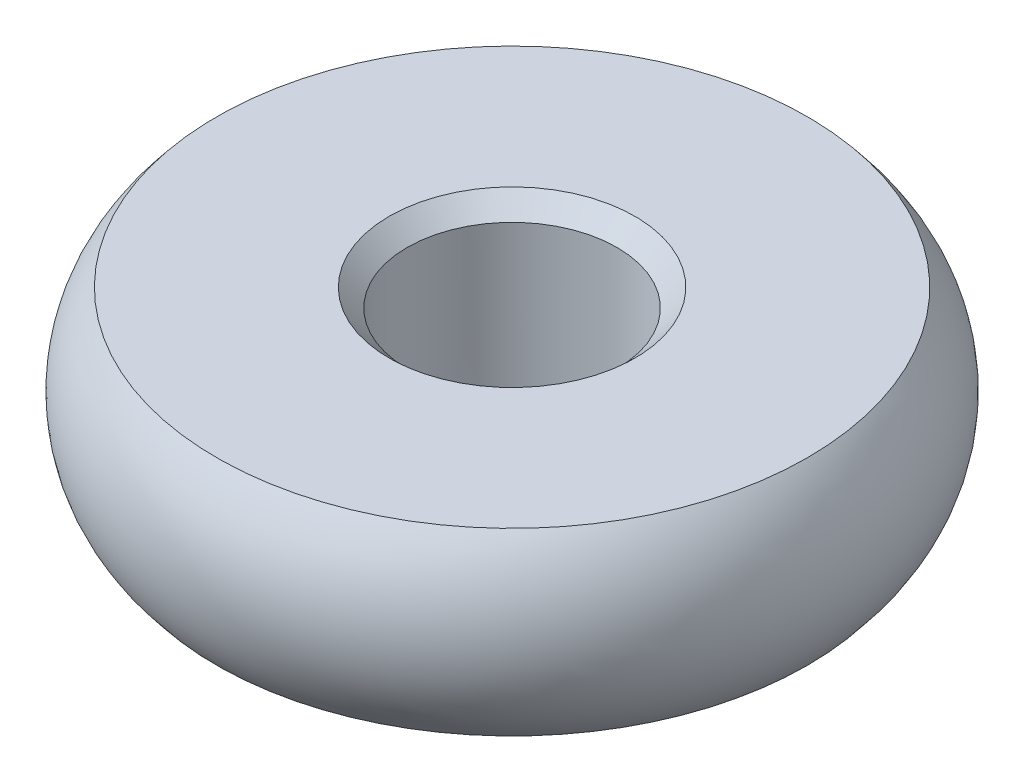
from build123d import *

# Parameters (mm, degrees)
CHAMFER1_SIZE = 3


with BuildPart() as part:
    # Sketch1 → Revolve1 (revolve)
    with BuildSketch(Plane.XY):
        with BuildLine():
            Line((49.270509831, 15), (17.5, 15))
            Line((17.5, 15), (17.5, -15))
            Line((17.5, -15), (49.270509831, -15))
            ThreePointArc((49.270509831, -15), (55, 0), (49.270509831, 15))
        make_face()
    revolve(axis=Axis((0, -860.231458205, 0), (0, 1, 0)))

    # Chamfer1
    chamfer1_edges = [part.edges().sort_by_distance(p)[0] for p in [
        (-17.5, 15, 0),
        (-17.5, -15, 0),
    ]]
    chamfer(chamfer1_edges, length=CHAMFER1_SIZE)


solid = part.part
